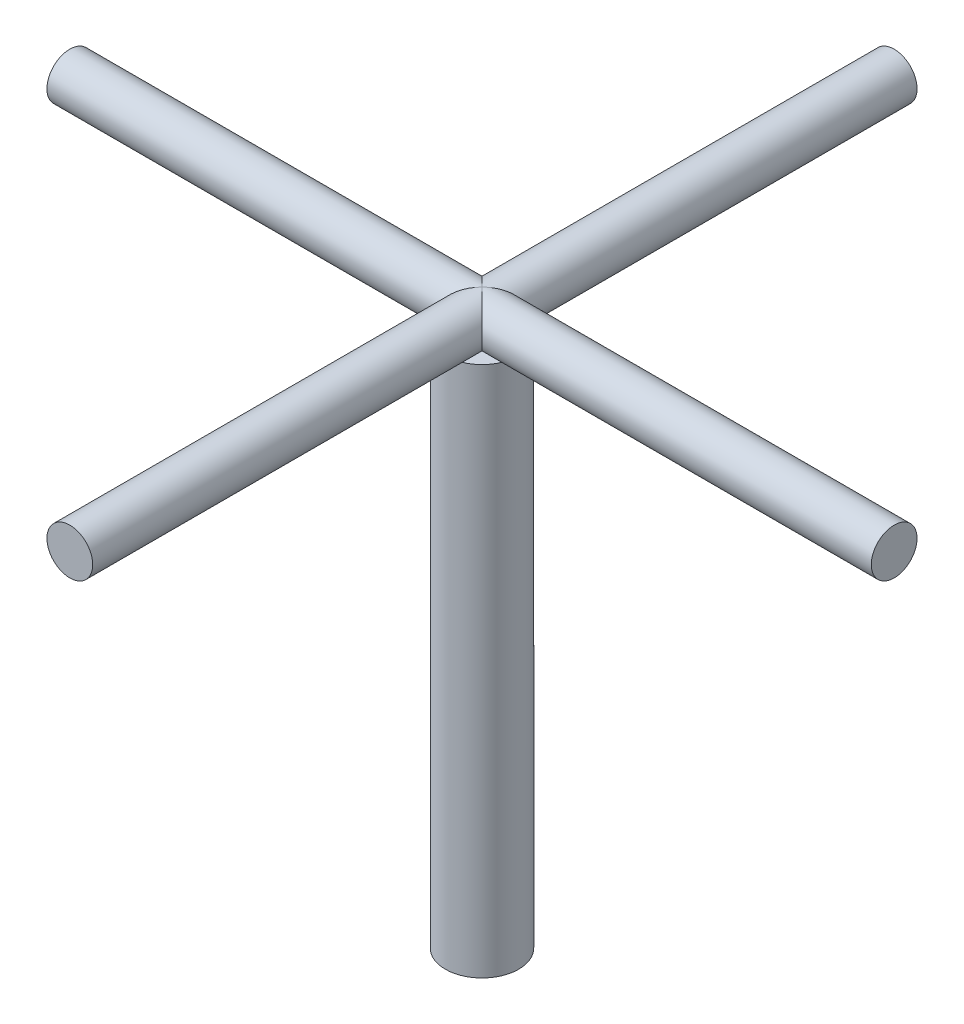
from build123d import *

# Parameters (mm, degrees)
SKETCH1_R             = 40
TRUNK_DEPTH           = 580
BRANCH_BASE_PROFILE_R = 25
BRANCHES_COUNT        = 4


with BuildPart() as part:
    # Sketch1 → trunk (new body)
    with BuildSketch(Plane(origin=(0, 0, 0), x_dir=(1, 0, 0), z_dir=(0, 1, 0))):
        with Locations(Location((0, 0, 0), (0, 0, 270))):
            Circle(SKETCH1_R)
    extrude(amount=TRUNK_DEPTH)

    # branch base: sweep along a path in Sketch2
    with BuildLine(Plane(origin=(0, 0, 0), x_dir=(0, 0, -1), z_dir=(1, 0, 0))) as branch_base_path:
        Line((0, 600), (-450, 600))
    # branch base profile (on start of the path) → branch base (sweep)
    with BuildSketch(Plane(origin=(0, 600, 0), x_dir=(0, 1, 0), z_dir=(0, 0, 1))):
        Circle(BRANCH_BASE_PROFILE_R)
    branch_base = sweep(path=branch_base_path.line)

    # branches: branch base ×4 about axis
    branches_axis = Axis((0, 0, 0), (0, 1, 0))
    for i in range(1, BRANCHES_COUNT):
        add(branch_base.rotate(branches_axis, i * 360 / BRANCHES_COUNT))


solid = part.part
